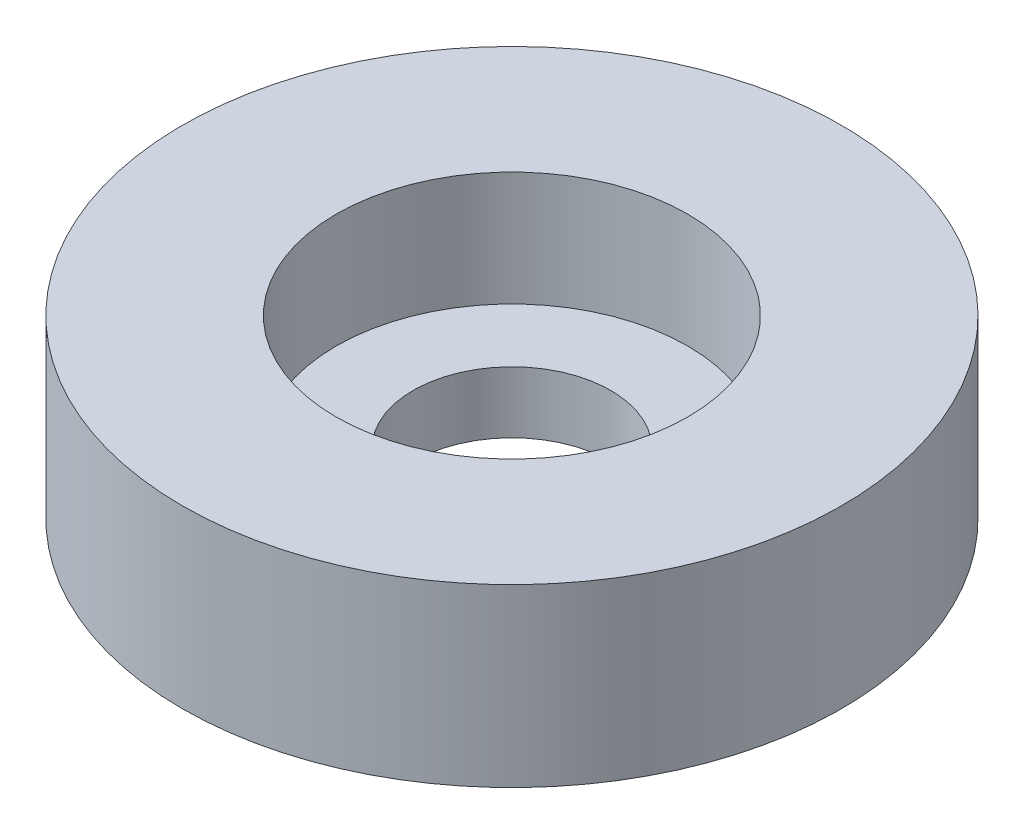
from build123d import *

# Parameters (mm, degrees)
ESBO_O1_R                                            = 7.5
RESSALTO_EXTRUS_O1_DEPTH                             = 4
REBAIXO_PARA_PARAFUSO_COM_CABE_A_REDONDA_D           = 4.5
REBAIXO_PARA_PARAFUSO_COM_CABE_A_REDONDA_CBORE_D     = 8
REBAIXO_PARA_PARAFUSO_COM_CABE_A_REDONDA_CBORE_DEPTH = 2.6


with BuildPart() as part:
    # Esboço1 → Ressalto-extrusão1 (new body)
    with BuildSketch(Plane(origin=(0, 0, 0), x_dir=(1, 0, 0), z_dir=(0, 1, 0))):
        with Locations(Location((0, 0, 0), (0, 0, 270))):
            Circle(ESBO_O1_R)
    extrude(amount=RESSALTO_EXTRUS_O1_DEPTH)

    # Rebaixo para parafuso com cabeça redonda de M41 (through all)
    with Locations(Plane(origin=(0, 4, 0), x_dir=(1, 0, 0), z_dir=(0, 1, 0))):
        with Locations((0, 0)):
            CounterBoreHole(REBAIXO_PARA_PARAFUSO_COM_CABE_A_REDONDA_D / 2, REBAIXO_PARA_PARAFUSO_COM_CABE_A_REDONDA_CBORE_D / 2, REBAIXO_PARA_PARAFUSO_COM_CABE_A_REDONDA_CBORE_DEPTH)


solid = part.part
